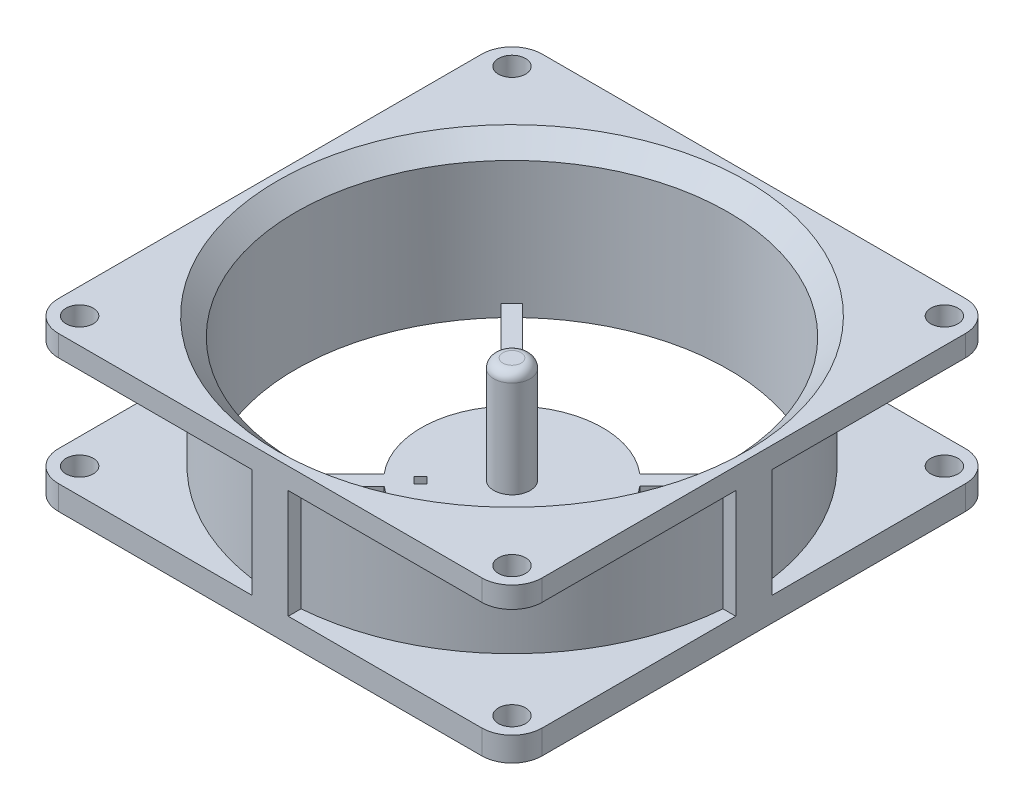
from build123d import *

# Parameters (mm, degrees)
SKETCH1_W            = 80
SKETCH1_H            = 80
BOSS_EXTRUDE1_DEPTH  = 25.5
SKETCH2_R            = 35.75
CUT_EXTRUDE2_DEPTH   = 28
BOSS_EXTRUDE2_START  = -2
BOSS_EXTRUDE2_DEPTH  = 2
CIRPATTERN2_COUNT    = 4
SKETCH5_R            = 15
BOSS_EXTRUDE3_DEPTH  = 2
SKETCH6_R            = 3
BOSS_EXTRUDE4_DEPTH  = 17.5
FILLET1_R            = 1.5
SKETCH7_R            = 70
SKETCH7_R_2          = 38
CUT_EXTRUDE4_DEPTH   = 18
FILLET2_R            = 5
BOSS_EXTRUDE5_START  = -20
BOSS_EXTRUDE5_DEPTH  = 20
CIRPATTERN3_COUNT    = 4
SKETCH9_R            = 2.25
CUT_EXTRUDE5_DEPTH   = 37
LPATTERN1_COUNT      = 2
LPATTERN1_PITCH      = 71.5
LPATTERN1_COUNT_DIR2 = 2
LPATTERN1_PITCH_DIR2 = 71.5
CHAMFER2_SIZE        = 3
CUT_EXTRUDE6_DEPTH   = 1
CUT_EXTRUDE7_DEPTH   = 7
SCALE1_SCALE         = 1.5


with BuildPart() as part:
    # Sketch1 → Boss-Extrude1 (new body)
    with BuildSketch(Plane(origin=(0, 0, 0), x_dir=(1, 0, 0), z_dir=(0, 1, 0))):
        Rectangle(SKETCH1_W, SKETCH1_H)
    extrude(amount=BOSS_EXTRUDE1_DEPTH)

    # Sketch2 → Cut-Extrude2 (cut)
    with BuildSketch(Plane(origin=(0, 25.5, 0), x_dir=(1, 0, 0), z_dir=(0, 1, 0))):
        with Locations(Location((0, 0, 0), (0, 0, 270))):
            Circle(SKETCH2_R)
    extrude(amount=-CUT_EXTRUDE2_DEPTH, mode=Mode.SUBTRACT)

    # Sketch4 → Boss-Extrude2 (add)
    with BuildSketch(Plane.XZ.offset(BOSS_EXTRUDE2_START)):
        with BuildLine():
            Line((-1.75, 0), (0, 1.785533906))
            Line((0, 1.785533906), (-24.370530875, 26.156064781))
            ThreePointArc((-24.370530875, 26.156064781), (-25.270176953, 25.287954776), (-26.138919431, 24.388919431))
            Line((-26.138919431, 24.388919431), (-1.75, 0))
        make_face()
    boss_extrude2 = extrude(amount=BOSS_EXTRUDE2_DEPTH)

    # CirPattern2: Boss-Extrude2 ×4 about axis
    cirpattern2_axis = Axis((0, 0, 0), (0, 1, 0))
    for i in range(1, CIRPATTERN2_COUNT):
        add(boss_extrude2.rotate(cirpattern2_axis, i * 360 / CIRPATTERN2_COUNT))

    # Sketch5 → Boss-Extrude3 (add)
    with BuildSketch(Plane.XZ):
        Circle(SKETCH5_R)
    extrude(amount=-BOSS_EXTRUDE3_DEPTH)

    # Sketch6 → Boss-Extrude4 (add)
    with BuildSketch(Plane(origin=(0, 2, 0), x_dir=(1, 0, 0), z_dir=(0, 1, 0))):
        with Locations(Location((0, 0, 0), (0, 0, 90))):
            Circle(SKETCH6_R)
    extrude(amount=BOSS_EXTRUDE4_DEPTH)

    # Fillet1
    fillet1_edges = [part.edges().sort_by_distance(p)[0] for p in [
        (0, 19.5, 3),
    ]]
    fillet(fillet1_edges, radius=FILLET1_R)

    # Sketch7 → Cut-Extrude4 (cut)
    with BuildSketch(Plane.XZ.offset(-4)):
        Circle(SKETCH7_R)
        with Locations(Location((0, 0, 0), (0, 0, 270))):
            Circle(SKETCH7_R_2, mode=Mode.SUBTRACT)
    extrude(amount=-CUT_EXTRUDE4_DEPTH, mode=Mode.SUBTRACT)

    # Fillet2
    fillet2_edges = [part.edges().sort_by_distance(p)[0] for p in [
        (-40, 2, -40),
        (40, 2, -40),
        (40, 2, 40),
        (-40, 2, 40),
        (-40, 23.75, -40),
        (40, 23.75, -40),
        (40, 23.75, 40),
        (-40, 23.75, 40),
    ]]
    fillet(fillet2_edges, radius=FILLET2_R)

    # Sketch8 → Boss-Extrude5 (add)
    with BuildSketch(Plane.XZ.offset(-4).offset(BOSS_EXTRUDE5_START)):
        with BuildLine():
            Line((-3, 40), (3, 40))
            Line((3, 40), (3, 35.623903492))
            ThreePointArc((3, 35.623903492), (0, 35.75), (-3, 35.623903492))
            Line((-3, 35.623903492), (-3, 40))
        make_face()
    boss_extrude5 = extrude(amount=BOSS_EXTRUDE5_DEPTH)

    # CirPattern3: Boss-Extrude5 ×4 about axis
    cirpattern3_axis = Axis((0, 0, 0), (0, 1, 0))
    for i in range(1, CIRPATTERN3_COUNT):
        add(boss_extrude5.rotate(cirpattern3_axis, i * 360 / CIRPATTERN3_COUNT))

    # Sketch9 → Cut-Extrude5 (cut)
    with BuildSketch(Plane(origin=(0, 25.5, 0), x_dir=(-1, 0, 0), z_dir=(0, 1, 0))):
        with Locations(Location((35.75, -35.75, 0), (0, 0, 90))):
            Circle(SKETCH9_R)
    cut_extrude5 = extrude(amount=-CUT_EXTRUDE5_DEPTH, mode=Mode.SUBTRACT)

    # LPattern1: Cut-Extrude5 2 × 2
    with Locations(*[(i * LPATTERN1_PITCH, 0, j * LPATTERN1_PITCH_DIR2) for i in range(LPATTERN1_COUNT) for j in range(LPATTERN1_COUNT_DIR2) if (i, j) != (0, 0)]):
        add(cut_extrude5, mode=Mode.SUBTRACT)

    # Chamfer2
    chamfer2_edges = [part.edges().sort_by_distance(p)[0] for p in [
        (0, 25.5, -35.75),
    ]]
    chamfer(chamfer2_edges, length=CHAMFER2_SIZE)

    # Sketch11 → Cut-Extrude6 (cut)
    with BuildSketch(Plane.XZ):
        Polygon((-28.863216429, 27.820323211), (-7.554875149, 6.51198193), (-6.494214977, 7.572642102), (-28.241896086, 29.320323211), (-40, 29.320323211), (-40, 27.820323211), align=None)
    extrude(amount=-CUT_EXTRUDE6_DEPTH, mode=Mode.SUBTRACT)

    # Sketch12 → Cut-Extrude7 (cut)
    with BuildSketch(Plane.XZ.offset(-1)):
        Polygon((-6.494214977, 7.572642102), (-7.554875149, 8.633302273), (-8.61553532, 7.572642102), (-7.554875149, 6.51198193), align=None)
    extrude(amount=-CUT_EXTRUDE7_DEPTH, mode=Mode.SUBTRACT)


with BuildPart() as part_1:
    # Scale1: scaled about (0.049360087, 11.297047604, -0.045989388)
    add(part.part.scale(SCALE1_SCALE).moved(Location((-0.024680043, -5.648523802, 0.022994694))))


solid = part_1.part
